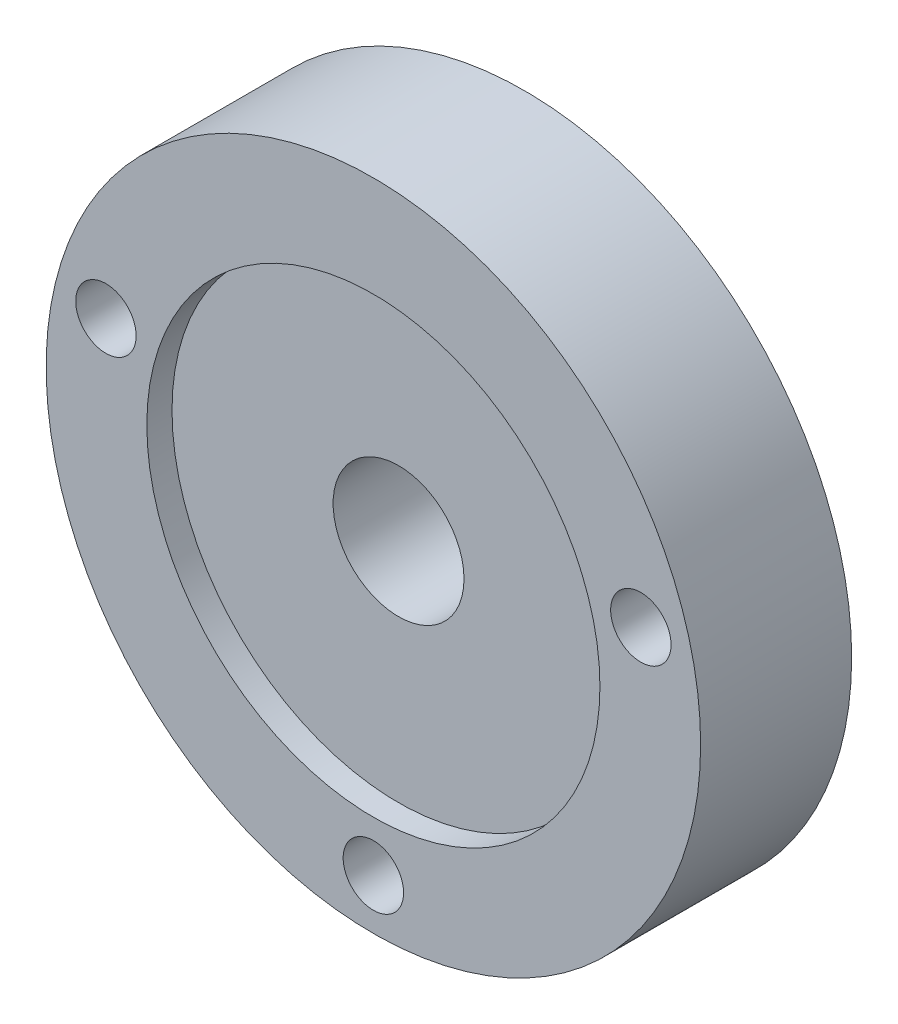
from build123d import *

# Parameters (mm, degrees)
ESQUISSE1_R                = 32.5
BOSS_EXTRU_1_DEPTH         = 15
ESQUISSE2_R                = 22.5
ENL_V_MAT_EXTRU_1_DEPTH    = 2.5
ESQUISSE3_R                = 6.5
ENL_V_MAT_EXTRU_2_DEPTH    = 48.631397208
TROUS_DE_CENTRAGE_6_0MM1_D = 6


with BuildPart() as part:
    # Esquisse1 → Boss.-Extru.1 (new body)
    with BuildSketch(Plane.XY):
        Circle(ESQUISSE1_R)
    extrude(amount=BOSS_EXTRU_1_DEPTH)

    # Esquisse2 → Enlèv. mat.-Extru.1 (cut)
    with BuildSketch(Plane.XY.offset(15)):
        Circle(ESQUISSE2_R)
    extrude(amount=-ENL_V_MAT_EXTRU_1_DEPTH, mode=Mode.SUBTRACT)

    # Esquisse3 → Enlèv. mat.-Extru.2 (cut, through all)
    with BuildSketch(Plane.XY.offset(12.5)):
        Circle(ESQUISSE3_R)
    extrude(amount=-ENL_V_MAT_EXTRU_2_DEPTH, mode=Mode.SUBTRACT)

    # Trous de centrage Ø6.0mm1 (through all)
    with Locations(Plane.XY.offset(15)):
        with Locations((0, -27.5), (-26.562960223, 7.11752374), (26.562960223, 7.11752374)):
            Hole(TROUS_DE_CENTRAGE_6_0MM1_D / 2)


solid = part.part
